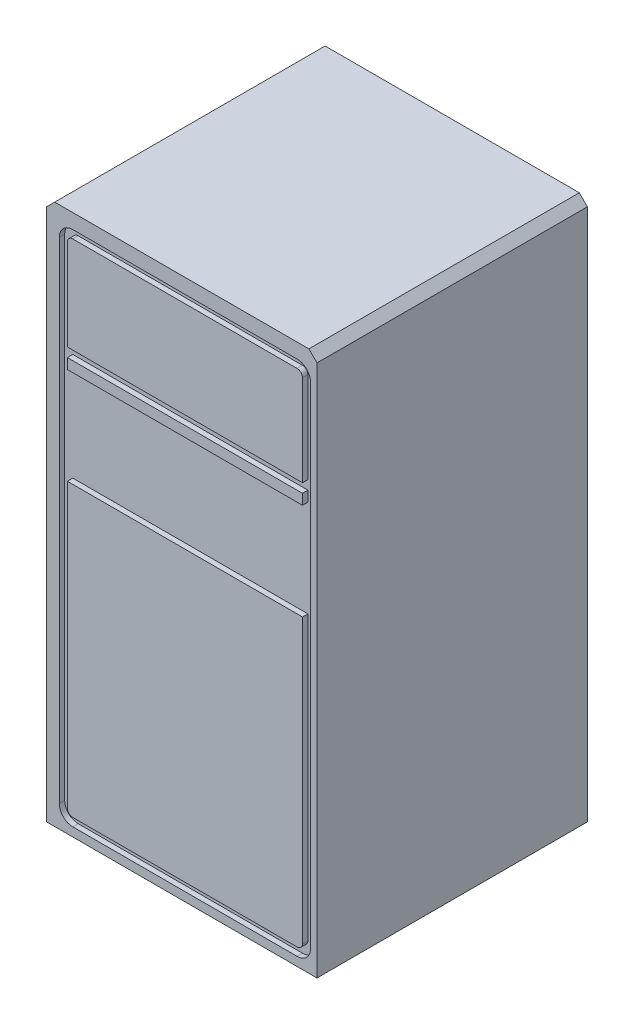
from build123d import *

# Parameters (mm, degrees)
CROQUIS1_W              = 1000
CROQUIS1_H              = 1000
SALIENTE_EXTRUIR1_DEPTH = 2000
CORTAR_EXTRUIR1_DEPTH   = 20
CROQUIS3_W              = 869.3440362
CROQUIS3_H              = 33.772787811
CORTAR_EXTRUIR2_DEPTH   = 20
CHAFL_N1_SIZE           = 30


with BuildPart() as part:
    # Croquis1 → Saliente-Extruir1 (new body)
    with BuildSketch(Plane(origin=(0, 0, 0), x_dir=(1, 0, 0), z_dir=(0, 1, 0))):
        Rectangle(CROQUIS1_W, CROQUIS1_H)
    extrude(amount=SALIENTE_EXTRUIR1_DEPTH)

    # Croquis2 → Cortar-Extruir1 (cut)
    with BuildSketch(Plane.XY.offset(500)):
        with BuildLine():
            Line((-453.105485689, 1895.512731964), (-453.105485689, 82.602501534))
            ThreePointArc((-453.105485689, 82.602501534), (-438.460824748, 47.247162475), (-403.105485689, 32.602501534))
            Line((-403.105485689, 32.602501534), (426.238550511, 32.602501534))
            ThreePointArc((426.238550511, 32.602501534), (461.59388957, 47.247162475), (476.238550511, 82.602501534))
            Line((476.238550511, 82.602501534), (476.238550511, 1895.512731964))
            ThreePointArc((476.238550511, 1895.512731964), (461.59388957, 1930.868071024), (426.238550511, 1945.512731964))
            Line((426.238550511, 1945.512731964), (-403.105485689, 1945.512731964))
            ThreePointArc((-403.105485689, 1945.512731964), (-438.460824748, 1930.868071024), (-453.105485689, 1895.512731964))
        make_face()
        with BuildLine():
            Line((-403.105485689, 1915.512731964), (426.238550511, 1915.512731964))
            ThreePointArc((426.238550511, 1915.512731964), (440.380686134, 1909.654867588), (446.238550511, 1895.512731964))
            Line((446.238550511, 1895.512731964), (446.238550511, 1487.15617354))
            Line((446.238550511, 1487.15617354), (-423.105485689, 1487.15617354))
            Line((-423.105485689, 1487.15617354), (-423.105485689, 1895.512731964))
            ThreePointArc((-423.105485689, 1895.512731964), (-417.247621312, 1909.654867588), (-403.105485689, 1915.512731964))
        make_face(mode=Mode.SUBTRACT)
        with BuildLine():
            Line((-403.105485689, 62.602501534), (426.238550511, 62.602501534))
            ThreePointArc((426.238550511, 62.602501534), (440.380686134, 68.460365911), (446.238550511, 82.602501534))
            Line((446.238550511, 82.602501534), (446.238550511, 1129.448445192))
            Line((446.238550511, 1129.448445192), (-423.105485689, 1129.448445192))
            Line((-423.105485689, 1129.448445192), (-423.105485689, 82.602501534))
            ThreePointArc((-423.105485689, 82.602501534), (-417.247621312, 68.460365911), (-403.105485689, 62.602501534))
        make_face(mode=Mode.SUBTRACT)
    extrude(amount=-CORTAR_EXTRUIR1_DEPTH, mode=Mode.SUBTRACT)

    # Croquis3 → Cortar-Extruir2 (cut)
    with BuildSketch(Plane.XY.offset(500)):
        with Locations((11.566532411, 1542.475404205)):
            Rectangle(CROQUIS3_W, CROQUIS3_H)
    extrude(amount=-CORTAR_EXTRUIR2_DEPTH, mode=Mode.SUBTRACT)

    # Chaflán1
    chafl_n1_edges = [part.edges().sort_by_distance(p)[0] for p in [
        (-500, 2000, 0),
        (500, 2000, 0),
    ]]
    chamfer(chafl_n1_edges, length=CHAFL_N1_SIZE)


solid = part.part
